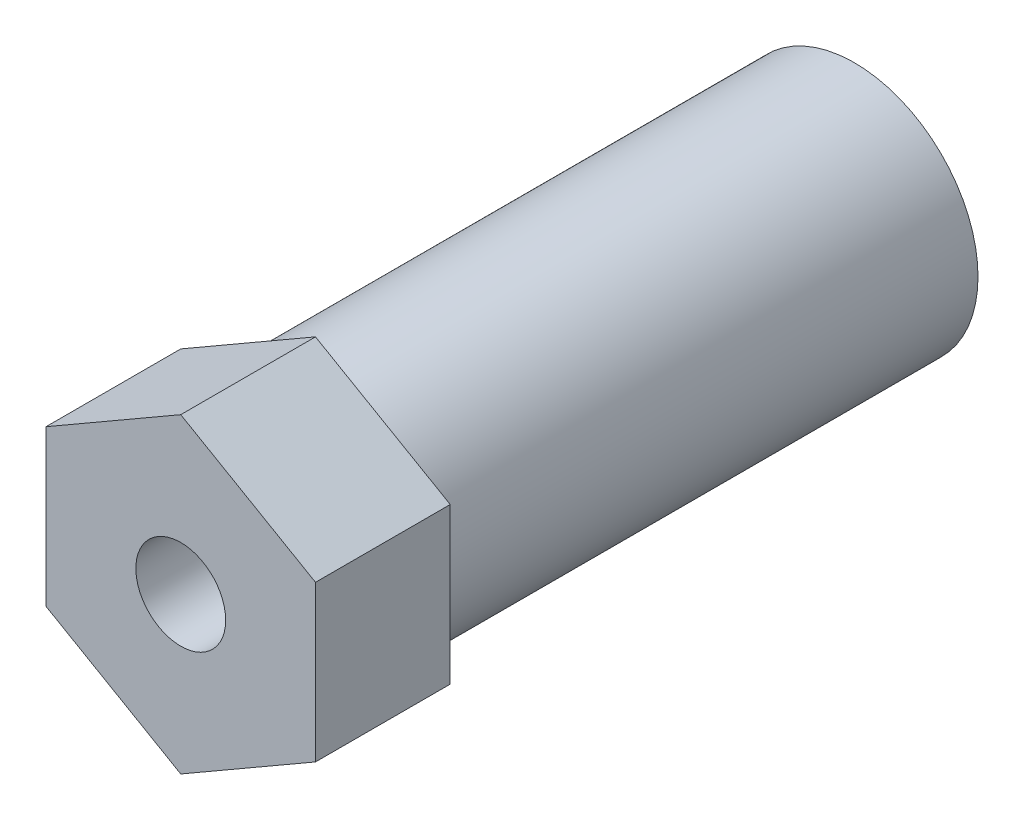
from build123d import *

# Parameters (mm, degrees)
SKETCH1_R           = 2
BOSS_EXTRUDE1_DEPTH = 6
SKETCH1_2_R         = 5.5
SKETCH1_2_R_2       = 2
BOSS_EXTRUDE3_DEPTH = 24
SKETCH2_R           = 3
CUT_EXTRUDE1_DEPTH  = 25


with BuildPart() as part:
    # Sketch1 → Boss-Extrude1 (new body)
    with BuildSketch(Plane.XY):
        Polygon((6, -3.464101615), (6, 3.464101615), (0, 6.92820323), (-6, 3.464101615), (-6, -3.464101615), (0, -6.92820323), align=None)
        Circle(SKETCH1_R, mode=Mode.SUBTRACT)
    extrude(amount=BOSS_EXTRUDE1_DEPTH)


with BuildPart() as body_2:
    # Sketch1<2> → Boss-Extrude3 (new body)
    with BuildSketch(Plane.XY):
        Circle(SKETCH1_2_R)
        Circle(SKETCH1_2_R_2, mode=Mode.SUBTRACT)
    extrude(amount=-BOSS_EXTRUDE3_DEPTH)

    # Sketch2 → Cut-Extrude1 (cut)
    with BuildSketch(Plane(origin=(0, 0, -24), x_dir=(-1, 0, 0), z_dir=(0, 0, -1))):
        Circle(SKETCH2_R)
    extrude(amount=-CUT_EXTRUDE1_DEPTH, mode=Mode.SUBTRACT)


solid = Compound([part.part, body_2.part])
